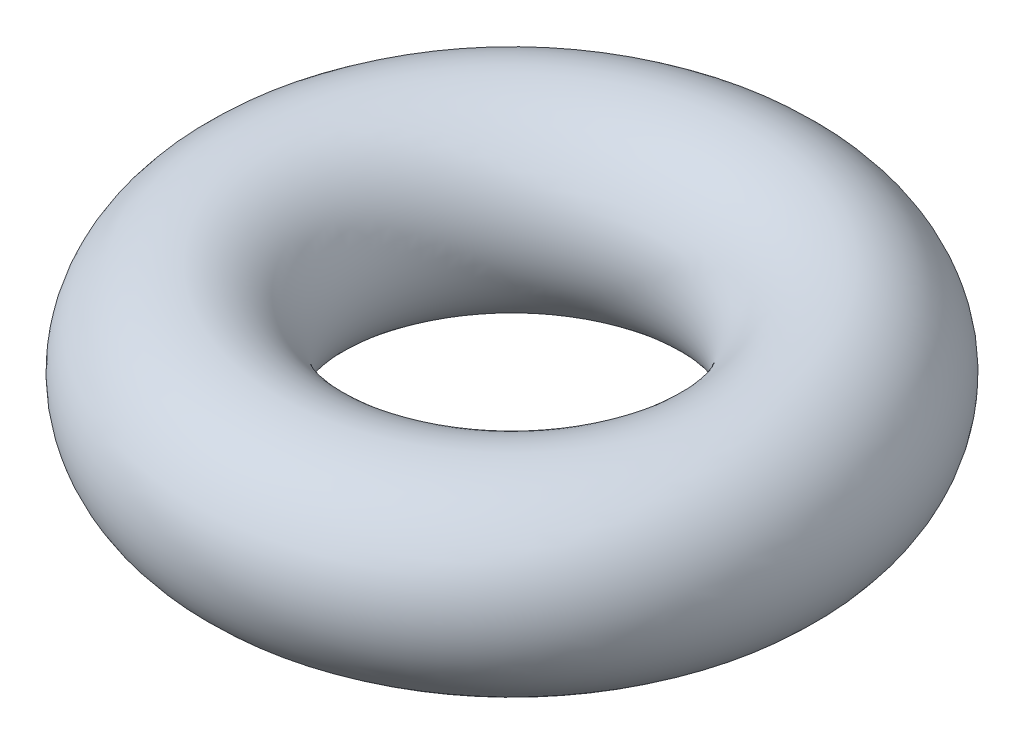
from build123d import *

# Parameters (mm, degrees)
SKETCH1_R = 1


with BuildPart() as part:
    # Sketch1 → Revolve1 (revolve)
    with BuildSketch(Plane.XY, mode=Mode.PRIVATE) as revolve1_sk:
        with Locations((2.5, 0)):
            Circle(SKETCH1_R)
    revolve(revolve1_sk.sketch.rotate(Axis((0, 4.854318368, 0), (0, -1, 0)), 90), axis=Axis((0, 4.854318368, 0), (0, -1, 0)))


solid = part.part
